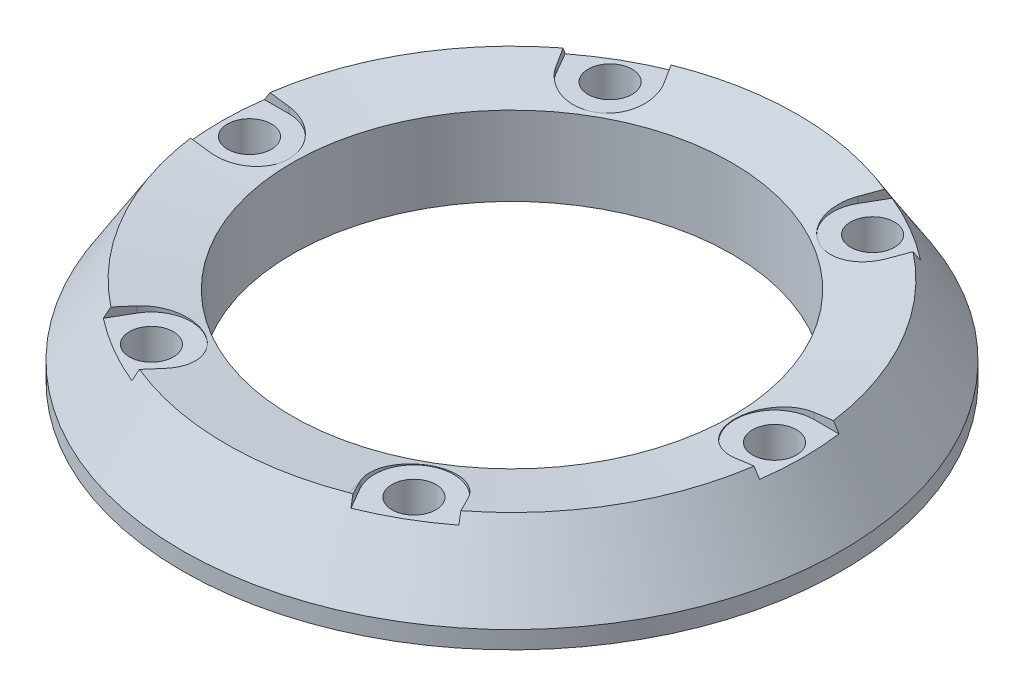
from build123d import *

# Parameters (mm, degrees)
SKETCH7_R          = 1.25
CUT_EXTRUDE2_DEPTH = 27.983791431
CUT_EXTRUDE3_DEPTH = 0.5
CIRPATTERN1_COUNT  = 6


with BuildPart() as part:
    # Sketch6 → Revolve1 (revolve)
    with BuildSketch(Plane.XY, mode=Mode.PRIVATE) as revolve1_sk:
        Polygon((12.5, 0), (18.75, 0), (18.75, 1), (16.25, 5), (12.5, 4.5), align=None)
    revolve(revolve1_sk.sketch.rotate(Axis((0, 0, 0), (0, 1, 0)), 90), axis=Axis((0, 0, 0), (0, 1, 0)))

    # Sketch7 → Cut-Extrude2 (cut, through all)
    with BuildSketch(Plane.XZ):
        with Locations(Location((14.999860612, 0.06466543, 0), (0, 0, 270))):
            Circle(SKETCH7_R)
    cut_extrude2 = extrude(amount=-CUT_EXTRUDE2_DEPTH, mode=Mode.SUBTRACT)

    # Sketch8 → Cut-Extrude3 (cut)
    with BuildSketch(Plane(origin=(0, 5, 0), x_dir=(-1, 0, 0), z_dir=(0, 1, 0))):
        with BuildLine():
            Line((-14.999860612, 2.31466543), (-18.708567664, 2.31466543))
            Line((-18.708567664, 2.31466543), (-18.708567664, -2.18533457))
            Line((-18.708567664, -2.18533457), (-14.999860612, -2.18533457))
            ThreePointArc((-14.999860612, -2.18533457), (-12.749860612, 0.06466543), (-14.999860612, 2.31466543))
        make_face()
    cut_extrude3 = extrude(amount=-CUT_EXTRUDE3_DEPTH, mode=Mode.SUBTRACT)

    # CirPattern1: Cut-Extrude2, Cut-Extrude3 ×6 about axis
    cirpattern1_axis = Axis((0, 0, 0), (0, 1, 0))
    add([cut_extrude2.rotate(cirpattern1_axis, i * 360 / CIRPATTERN1_COUNT) for i in range(1, CIRPATTERN1_COUNT)], mode=Mode.SUBTRACT)
    add([cut_extrude3.rotate(cirpattern1_axis, i * 360 / CIRPATTERN1_COUNT) for i in range(1, CIRPATTERN1_COUNT)], mode=Mode.SUBTRACT)


solid = part.part
